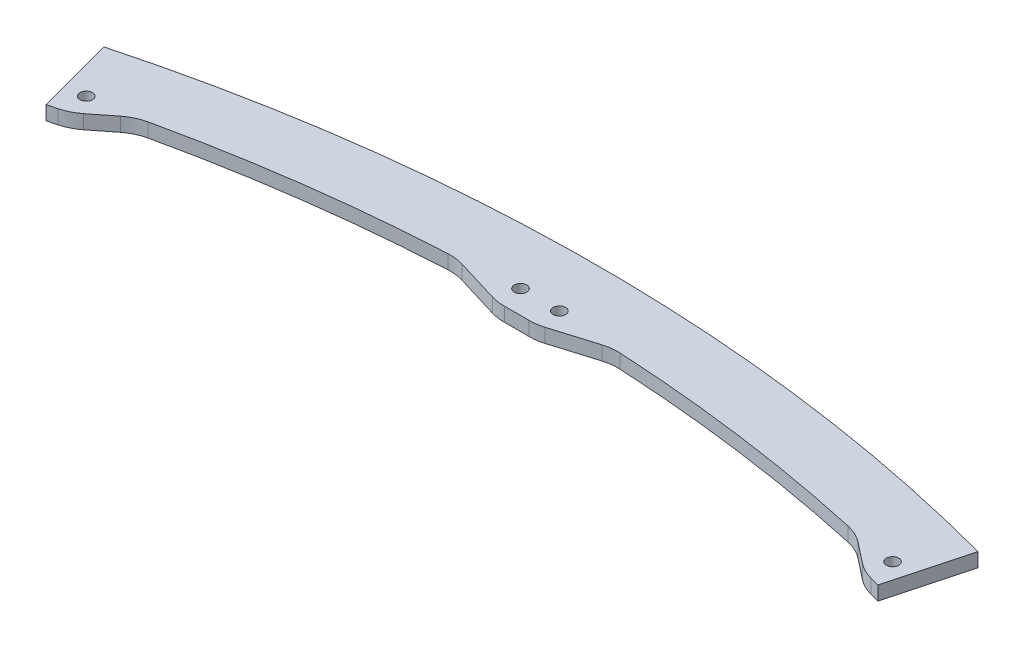
from build123d import *

# Parameters (mm, degrees)
SKETCH1_R           = 4
BOSS_EXTRUDE1_DEPTH = 9
FILLET1_R           = 30


with BuildPart() as part:
    # Sketch1 → Boss-Extrude1 (new body)
    with BuildSketch(Plane(origin=(0, 0, 0), x_dir=(1, 0, 0), z_dir=(0, 1, 0))):
        with BuildLine():
            ThreePointArc((-267.230664068, 997.318415643), (-261.188620877, 998.917791575), (-255.137006757, 1000.480563421))
            Line((-255.137006757, 1000.480563421), (-231.630657469, 1019.00551447))
            ThreePointArc((-231.630657469, 1019.00551447), (-141.360133679, 1035.394761724), (-50, 1043.80314236))
            Line((-50, 1043.80314236), (-12.5, 1032.424331368))
            ThreePointArc((-12.5, 1032.424331368), (0, 1032.5), (12.5, 1032.424331368))
            Line((12.5, 1032.424331368), (50, 1043.80314236))
            ThreePointArc((50, 1043.80314236), (141.360133679, 1035.394761724), (231.630657469, 1019.00551447))
            Line((231.630657469, 1019.00551447), (255.137006757, 1000.480563421))
            ThreePointArc((255.137006757, 1000.480563421), (261.188620877, 998.917791575), (267.230664068, 997.318415643))
            Line((267.230664068, 997.318415643), (280.818663936, 1048.029521524))
            ThreePointArc((280.818663936, 1048.029521524), (0, 1085), (-280.818663936, 1048.029521524))
            Line((-280.818663936, 1048.029521524), (-267.230664068, 997.318415643))
        make_face()
        with Locations(Location((-12.5, 1047.425415006, 0), (0, 0, 270))):
            Circle(SKETCH1_R, mode=Mode.SUBTRACT)
        with Locations(Location((12.5, 1047.425415006, 0), (0, 0, 270))):
            Circle(SKETCH1_R, mode=Mode.SUBTRACT)
        with Locations(Location((-259.019572899, 1014.970497529, 0), (0, 0, 270))):
            Circle(SKETCH1_R, mode=Mode.SUBTRACT)
        with Locations(Location((259.019572899, 1014.970497529, 0), (0, 0, 270))):
            Circle(SKETCH1_R, mode=Mode.SUBTRACT)
    extrude(amount=BOSS_EXTRUDE1_DEPTH)

    # Fillet1
    fillet1_edges = [part.edges().sort_by_distance(p)[0] for p in [
        (50, 4.5, -1043.80314236),
        (12.5, 4.5, -1032.424331368),
        (-12.5, 4.5, -1032.424331368),
        (-50, 4.5, -1043.80314236),
        (-231.630657469, 4.5, -1019.00551447),
        (-255.137006757, 4.5, -1000.480563421),
        (255.137006757, 4.5, -1000.480563421),
        (231.630657469, 4.5, -1019.00551447),
    ]]
    fillet(fillet1_edges, radius=FILLET1_R)


solid = part.part
